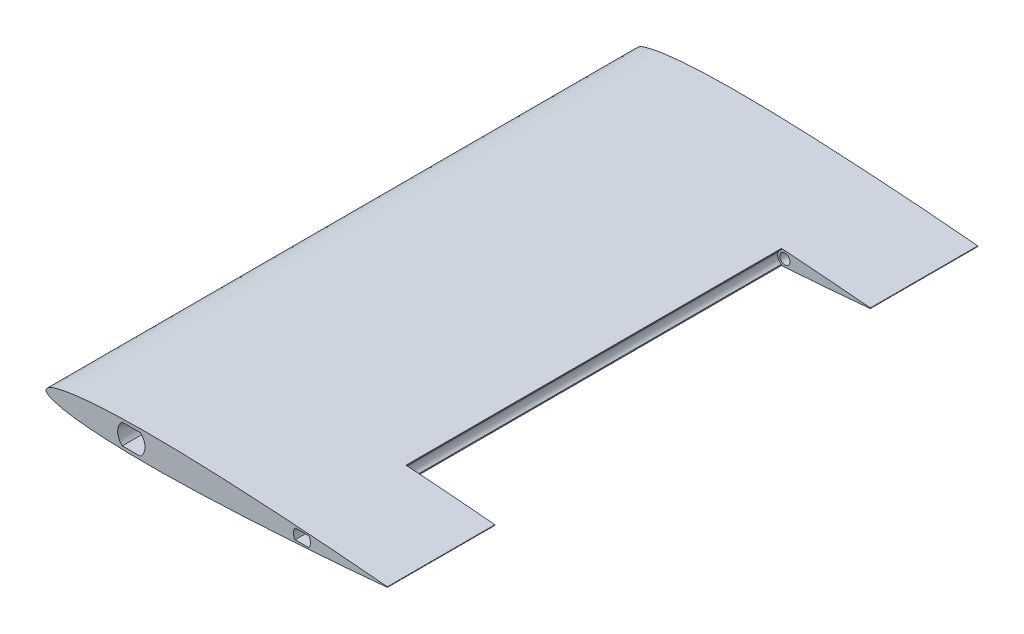
from build123d import *

# Parameters (mm, degrees)
FOAMALTA_DEPTH                 = 31.5
FOAMMEDIA_DEPTH                = 110
SCHIZZO4_W                     = 1
SCHIZZO4_H                     = 4.352344546
SMUSSOPARTEMOBILE_DEPTH        = 110
FOAMBASSA_DEPTH                = 31.5
FOROPERNORUDDEVATOR_DEPTH      = 174.363967164
FOROPERNORUDDEVATOR_DEPTH_BACK = 174.363967164
SCHIZZO5_R                     = 1.5
SCHIZZO8_R                     = 3
FOROLONGHERONE_DEPTH           = 200.904514999
AGGANCIOLONGHERONEALTO_DEPTH   = 15
AGGANCIOPERNOALTO_DEPTH        = 15
AGGANCILATOBASSO_START         = -15
AGGANCILATOBASSO_DEPTH         = 15


with BuildPart() as part:
    # Schizzo1 → FoamAlta (new body)
    with BuildSketch(Plane.XY):
        with BuildLine():
            ThreePointArc((100, 0.084), (100.084, 0), (100, -0.084))
            add(Edge.make_bspline(
                [(100, 0.084), (98.333488815, 0.23674648), (95.001194725, 0.542172689), (88.335559621, 1.11089898), (80.003293356, 1.763610995), (70.002998933, 2.457861693), (60.003104625, 3.061747723), (50.003008601, 3.552139212), (40.002598558, 3.902946494), (31.666961486, 4.025260151), (24.9991546, 3.976933791), (19.997775587, 3.844976398), (14.993363131, 3.592486959), (10.827184065, 3.237651579), (7.489054388, 2.814021367), (4.99359465, 2.403673059), (2.84962634, 1.867925494), (1.165413503, 1.320987252), (-0.664613784, 0), (1.165413503, -1.320987252), (2.84962634, -1.867925494), (4.99359465, -2.403673059), (7.489054388, -2.814021367), (10.827184065, -3.237651579), (14.993363131, -3.592486959), (19.997775587, -3.844976398), (24.9991546, -3.976933791), (31.666961486, -4.025260151), (40.002598558, -3.902946494), (50.003008601, -3.552139212), (60.003104625, -3.061747723), (70.002998933, -2.457861693), (80.003293356, -1.763610995), (88.335559621, -1.11089898), (95.001194725, -0.542172689), (98.333488815, -0.23674648), (100, -0.084)],
                knots=[0, 0, 0, 0, 0.024876293, 0.049741715, 0.099443402, 0.149112224, 0.198750974, 0.248359097, 0.29793737, 0.347491327, 0.37226694, 0.397050924, 0.421859475, 0.446731346, 0.459220451, 0.471790602, 0.484560454, 0.491195112, 0.5, 0.508804888, 0.515439546, 0.528209398, 0.540779549, 0.553268654, 0.578140525, 0.602949076, 0.62773306, 0.652508673, 0.70206263, 0.751640903, 0.801249026, 0.850887776, 0.900556598, 0.950258285, 0.975123707, 1, 1, 1, 1], degree=3))
        make_face()
    extrude(amount=FOAMALTA_DEPTH)

    # Schizzo2 → FoamMedia (add)
    with BuildSketch(Plane.XY.offset(31.5)):
        with BuildLine():
            ThreePointArc((75, 2.107216055), (72.892783944, 0), (75, -2.107216055))
            add(Edge.make_bspline(
                [(75, 2.107216055), (73.333587352, 2.222873526), (68.33507528, 2.558586337), (60.003104625, 3.061747723), (50.003008601, 3.552139212), (40.002598558, 3.902946494), (31.666961486, 4.025260151), (24.9991546, 3.976933791), (19.997775587, 3.844976398), (14.993363131, 3.592486959), (10.827184065, 3.237651579), (7.489054388, 2.814021367), (4.99359465, 2.403673059), (2.84962634, 1.867925494), (1.165413503, 1.320987252), (-0.664613784, 0), (1.165413503, -1.320987252), (2.84962634, -1.867925494), (4.99359465, -2.403673059), (7.489054388, -2.814021367), (10.827184065, -3.237651579), (14.993363131, -3.592486959), (19.997775587, -3.844976398), (24.9991546, -3.976933791), (31.666961486, -4.025260151), (40.002598558, -3.902946494), (50.003008601, -3.552139212), (60.003104625, -3.061747723), (68.33507528, -2.558586337), (73.333587352, -2.222873526), (75, -2.107216055)],
                knots=[0.124281666, 0.124281666, 0.124281666, 0.124281666, 0.149112224, 0.198750974, 0.248359097, 0.29793737, 0.347491327, 0.37226694, 0.397050924, 0.421859475, 0.446731346, 0.459220451, 0.471790602, 0.484560454, 0.491195112, 0.5, 0.508804888, 0.515439546, 0.528209398, 0.540779549, 0.553268654, 0.578140525, 0.602949076, 0.62773306, 0.652508673, 0.70206263, 0.751640903, 0.801249026, 0.850887776, 0.875718334, 0.875718334, 0.875718334, 0.875718334], degree=3))
        make_face()
    extrude(amount=FOAMMEDIA_DEPTH)

    # Schizzo4 → SmussoParteMobile (cut)
    with BuildSketch(Plane.XY.offset(141.5)):
        with Locations((74.5, 0)):
            Rectangle(SCHIZZO4_W, SCHIZZO4_H)
    extrude(amount=-SMUSSOPARTEMOBILE_DEPTH, mode=Mode.SUBTRACT)

    # Schizzo6 → FoamBassa (add)
    with BuildSketch(Plane.XY.offset(141.5)):
        with BuildLine():
            ThreePointArc((100, 0.084), (100.084, 0), (100, -0.084))
            add(Edge.make_bspline(
                [(100, 0.084), (98.333488815, 0.23674648), (95.001194725, 0.542172689), (88.335559621, 1.11089898), (80.003293356, 1.763610995), (70.002998933, 2.457861693), (60.003104625, 3.061747723), (50.003008601, 3.552139212), (40.002598558, 3.902946494), (31.666961486, 4.025260151), (24.9991546, 3.976933791), (19.997775587, 3.844976398), (14.993363131, 3.592486959), (10.827184065, 3.237651579), (7.489054388, 2.814021367), (4.99359465, 2.403673059), (2.84962634, 1.867925494), (1.165413503, 1.320987252), (-0.664613784, 0), (1.165413503, -1.320987252), (2.84962634, -1.867925494), (4.99359465, -2.403673059), (7.489054388, -2.814021367), (10.827184065, -3.237651579), (14.993363131, -3.592486959), (19.997775587, -3.844976398), (24.9991546, -3.976933791), (31.666961486, -4.025260151), (40.002598558, -3.902946494), (50.003008601, -3.552139212), (60.003104625, -3.061747723), (70.002998933, -2.457861693), (80.003293356, -1.763610995), (88.335559621, -1.11089898), (95.001194725, -0.542172689), (98.333488815, -0.23674648), (100, -0.084)],
                knots=[0, 0, 0, 0, 0.024876293, 0.049741715, 0.099443402, 0.149112224, 0.198750974, 0.248359097, 0.29793737, 0.347491327, 0.37226694, 0.397050924, 0.421859475, 0.446731346, 0.459220451, 0.471790602, 0.484560454, 0.491195112, 0.5, 0.508804888, 0.515439546, 0.528209398, 0.540779549, 0.553268654, 0.578140525, 0.602949076, 0.62773306, 0.652508673, 0.70206263, 0.751640903, 0.801249026, 0.850887776, 0.900556598, 0.950258285, 0.975123707, 1, 1, 1, 1], degree=3))
        make_face()
    extrude(amount=FOAMBASSA_DEPTH)

    # Schizzo5 → ForoPernoRuddevator (cut, two sides: drawn at the far end of the back side and taken through both)
    with BuildSketch(Plane.XY.offset(31.5).offset(-FOROPERNORUDDEVATOR_DEPTH_BACK)):
        with Locations((75, 0)):
            Circle(SCHIZZO5_R)
    extrude(amount=FOROPERNORUDDEVATOR_DEPTH + FOROPERNORUDDEVATOR_DEPTH_BACK, mode=Mode.SUBTRACT)

    # Schizzo8 → ForoLongherone (cut, through all)
    with BuildSketch(Plane(origin=(0, 0, 0), x_dir=(-1, 0, 0), z_dir=(0, 0, -1))):
        with Locations((-25, 0)):
            Circle(SCHIZZO8_R)
    extrude(amount=-FOROLONGHERONE_DEPTH, mode=Mode.SUBTRACT)

    # Schizzo9 → AggancioLongheroneAlto (cut)
    with BuildSketch(Plane(origin=(0, 0, 0), x_dir=(-1, 0, 0), z_dir=(0, 0, -1))):
        with BuildLine():
            Line((-27.645751311, 3), (-22.354248689, 3))
            ThreePointArc((-22.354248689, 3), (-21, 0), (-22.354248689, -3))
            Line((-22.354248689, -3), (-27.645751311, -3))
            ThreePointArc((-27.645751311, -3), (-29, 0), (-27.645751311, 3))
        make_face()
    extrude(amount=-AGGANCIOLONGHERONEALTO_DEPTH, mode=Mode.SUBTRACT)

    # Schizzo10 → AggancioPernoAlto (cut)
    with BuildSketch(Plane(origin=(0, 0, 0), x_dir=(-1, 0, 0), z_dir=(0, 0, -1))):
        with BuildLine():
            Line((-77, 1.5), (-73, 1.5))
            ThreePointArc((-73, 1.5), (-72.5, 0), (-73, -1.5))
            Line((-73, -1.5), (-77, -1.5))
            ThreePointArc((-77, -1.5), (-77.5, 0), (-77, 1.5))
        make_face()
    extrude(amount=-AGGANCIOPERNOALTO_DEPTH, mode=Mode.SUBTRACT)

    # Schizzo11 → AgganciLatoBasso (cut)
    with BuildSketch(Plane.XY.offset(173).offset(AGGANCILATOBASSO_START)):
        with BuildLine():
            Line((22.354248689, 3), (27.645751311, 3))
            ThreePointArc((27.645751311, 3), (29, 0), (27.645751311, -3))
            Line((27.645751311, -3), (22.354248689, -3))
            ThreePointArc((22.354248689, -3), (21, 0), (22.354248689, 3))
        make_face()
        with BuildLine():
            Line((73, 1.5), (77, 1.5))
            ThreePointArc((77, 1.5), (77.5, 0), (77, -1.5))
            Line((77, -1.5), (73, -1.5))
            ThreePointArc((73, -1.5), (72.5, 0), (73, 1.5))
        make_face()
    extrude(amount=AGGANCILATOBASSO_DEPTH, mode=Mode.SUBTRACT)


solid = part.part
